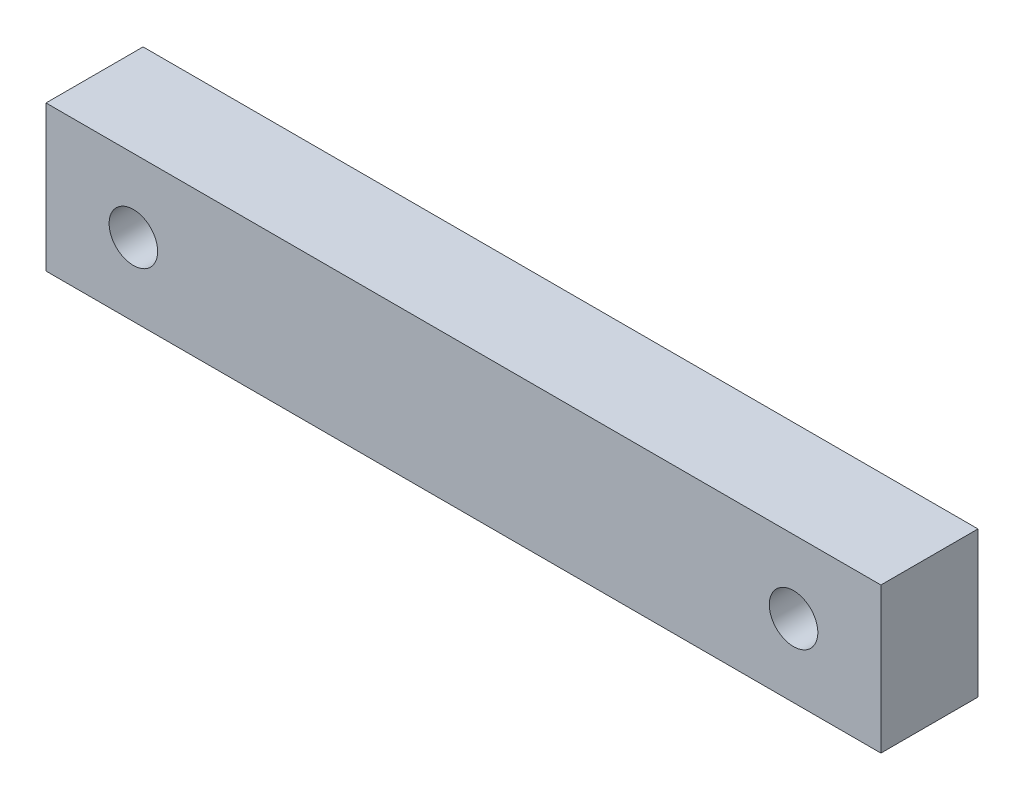
from build123d import *

# Parameters (mm, degrees)
SKETCH1_W           = 86
SKETCH1_H           = 15
SKETCH1_R           = 2.5
BOSS_EXTRUDE1_DEPTH = 10


with BuildPart() as part:
    # Sketch1 → Boss-Extrude1 (new body)
    with BuildSketch(Plane.XY):
        with Locations((43, 7.5)):
            Rectangle(SKETCH1_W, SKETCH1_H)
        with Locations((9, 7.5)):
            Circle(SKETCH1_R, mode=Mode.SUBTRACT)
        with Locations(Location((77, 7.5, 0), (0, 0, 180))):
            Circle(SKETCH1_R, mode=Mode.SUBTRACT)
    extrude(amount=BOSS_EXTRUDE1_DEPTH)


solid = part.part
